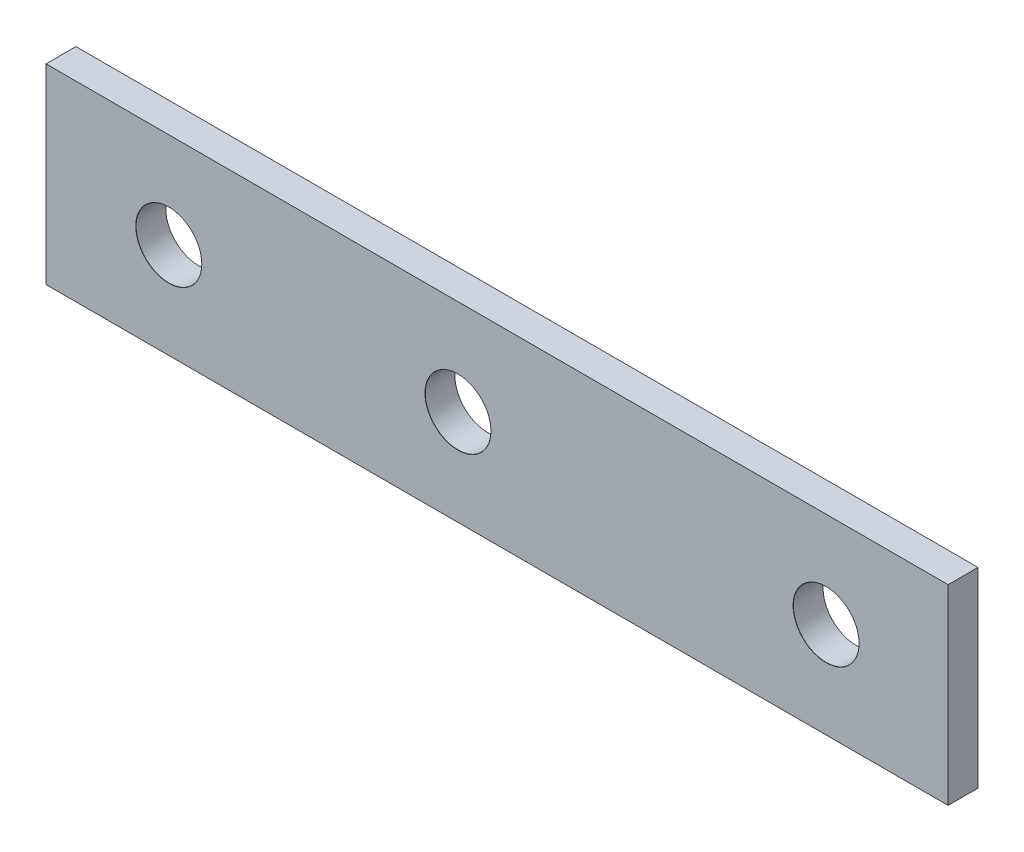
from build123d import *

# Parameters (mm, degrees)
ESQUISSE1_W                 = 151
ESQUISSE1_H                 = 32
BOSS_EXTRU_1_DEPTH          = 5
D_GAGEMENT_M101_D           = 11
D_GAGEMENT_M101_DEPTH       = 37
D_GAGEMENT_M101_CSINK_D     = 11.05
D_GAGEMENT_M101_CSINK_ANGLE = 90
D_GAGEMENT_M101_TIP         = 3.304733405


with BuildPart() as part:
    # Esquisse1 → Boss.-Extru.1 (new body)
    with BuildSketch(Plane.XY):
        with Locations((75.5, 16)):
            Rectangle(ESQUISSE1_W, ESQUISSE1_H)
    extrude(amount=BOSS_EXTRU_1_DEPTH)

    # Dégagement M101
    with Locations(Plane(origin=(20.552465295, 16, 5), x_dir=(1, 0, 0), z_dir=(0, 0, 1))):
        with Locations((0, 0), (48.398815016, 0), (110.018769744, 0)):
            CounterSinkHole(D_GAGEMENT_M101_D / 2, D_GAGEMENT_M101_CSINK_D / 2, depth=D_GAGEMENT_M101_DEPTH, counter_sink_angle=D_GAGEMENT_M101_CSINK_ANGLE)
            with Locations((0, 0, -(D_GAGEMENT_M101_DEPTH + D_GAGEMENT_M101_TIP / 2))):  # 118° drill point
                Cone(0, D_GAGEMENT_M101_D / 2, D_GAGEMENT_M101_TIP, mode=Mode.SUBTRACT)


solid = part.part
